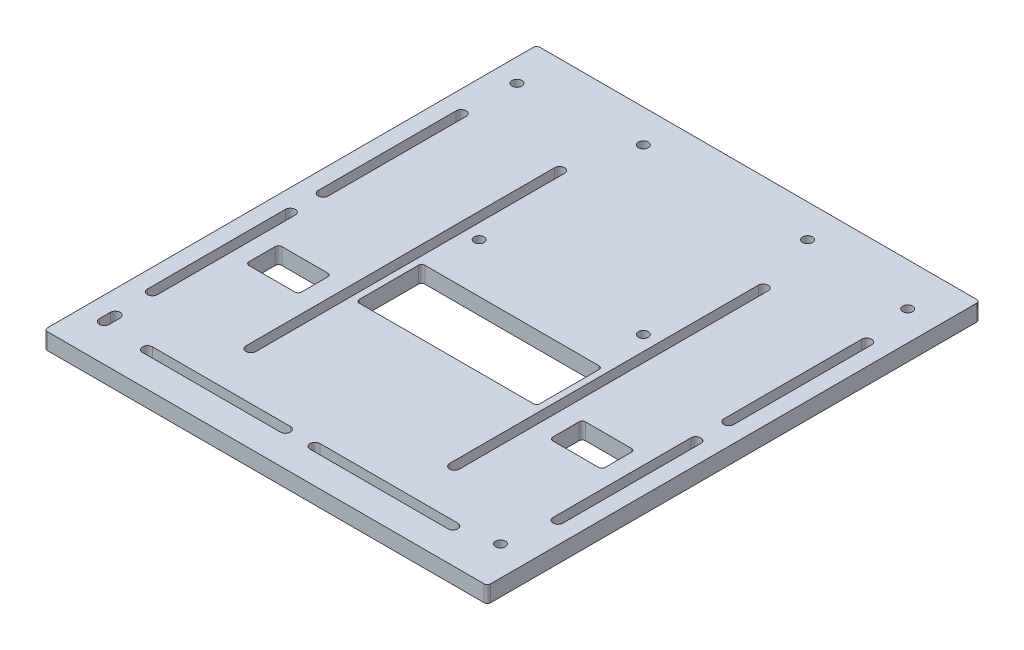
from build123d import *

# Parameters (mm, degrees)
BOSS_EXTRUDE1_DEPTH = 5
CUT_EXTRUDE1_DEPTH  = 5
CUT_EXTRUDE2_DEPTH  = 5
SKETCH7_R           = 1.5
CUT_EXTRUDE3_DEPTH  = 5
CUT_EXTRUDE4_DEPTH  = 5
SKETCH10_R          = 1.5
CUT_EXTRUDE5_DEPTH  = 5
CUT_EXTRUDE6_DEPTH  = 5
CUT_EXTRUDE7_DEPTH  = 5


with BuildPart() as part:
    # Sketch1 → Boss-Extrude1 (new body)
    with BuildSketch(Plane(origin=(0, 0, 0), x_dir=(1, 0, 0), z_dir=(0, 1, 0))):
        with BuildLine():
            Line((-4.859778007, 4.413916891), (128.140221993, 4.413916891))
            ThreePointArc((128.140221993, 4.413916891), (128.847328775, 4.121023672), (129.140221993, 3.413916891))
            Line((129.140221993, 3.413916891), (129.140221993, -144.586083109))
            ThreePointArc((129.140221993, -144.586083109), (128.847328775, -145.29318989), (128.140221993, -145.586083109))
            Line((128.140221993, -145.586083109), (-4.859778007, -145.586083109))
            ThreePointArc((-4.859778007, -145.586083109), (-5.566884788, -145.29318989), (-5.859778007, -144.586083109))
            Line((-5.859778007, -144.586083109), (-5.859778007, 3.413916891))
            ThreePointArc((-5.859778007, 3.413916891), (-5.566884788, 4.121023672), (-4.859778007, 4.413916891))
        make_face()
    extrude(amount=BOSS_EXTRUDE1_DEPTH)

    # Sketch3 → Cut-Extrude1 (cut)
    with BuildSketch(Plane(origin=(75.20450804, 5, 34.196611672), x_dir=(1, 0, 0), z_dir=(0, 1, 0))):
        with BuildLine():
            Line((45.935713953, -83.389471436), (45.935713953, -41.389471436))
            ThreePointArc((45.935713953, -41.389471436), (47.435713953, -39.889471436), (48.935713953, -41.389471436))
            Line((48.935713953, -41.389471436), (48.935713953, -83.389471436))
            ThreePointArc((48.935713953, -83.389471436), (47.435713953, -84.889471436), (45.935713953, -83.389471436))
        make_face()
        with BuildLine():
            Line((45.935713953, -31.389471436), (45.935713953, 10.610528564))
            ThreePointArc((45.935713953, 10.610528564), (47.435713953, 12.110528564), (48.935713953, 10.610528564))
            Line((48.935713953, 10.610528564), (48.935713953, -31.389471436))
            ThreePointArc((48.935713953, -31.389471436), (47.435713953, -32.889471436), (45.935713953, -31.389471436))
        make_face()
        with BuildLine():
            Line((-73.064286047, -84.889471436), (-73.064286047, -42.889471436))
            ThreePointArc((-73.064286047, -42.889471436), (-74.564286047, -41.389471436), (-76.064286047, -42.889471436))
            Line((-76.064286047, -42.889471436), (-76.064286047, -84.889471436))
            ThreePointArc((-76.064286047, -84.889471436), (-74.564286047, -86.389471436), (-73.064286047, -84.889471436))
        make_face()
        with BuildLine():
            Line((-73.064286047, -32.889471436), (-73.064286047, 9.110528564))
            ThreePointArc((-73.064286047, 9.110528564), (-74.564286047, 10.610528564), (-76.064286047, 9.110528564))
            Line((-76.064286047, 9.110528564), (-76.064286047, -32.889471436))
            ThreePointArc((-76.064286047, -32.889471436), (-74.564286047, -34.389471436), (-73.064286047, -32.889471436))
        make_face()
    extrude(amount=-CUT_EXTRUDE1_DEPTH, mode=Mode.SUBTRACT)

    # Sketch5 → Cut-Extrude2 (cut)
    with BuildSketch(Plane(origin=(75.20450804, 5, 34.196611672), x_dir=(1, 0, 0), z_dir=(0, 1, 0))):
        with BuildLine():
            Line((-60.064286047, -99.389471436), (-18.064286047, -99.389471436))
            ThreePointArc((-18.064286047, -99.389471436), (-16.564286047, -100.889471436), (-18.064286047, -102.389471436))
            Line((-18.064286047, -102.389471436), (-60.064286047, -102.389471436))
            ThreePointArc((-60.064286047, -102.389471436), (-61.564286047, -100.889471436), (-60.064286047, -99.389471436))
        make_face()
        with BuildLine():
            Line((-9.064286047, -99.389471436), (32.935713953, -99.389471436))
            ThreePointArc((32.935713953, -99.389471436), (34.435713953, -100.889471436), (32.935713953, -102.389471436))
            Line((32.935713953, -102.389471436), (-9.064286047, -102.389471436))
            ThreePointArc((-9.064286047, -102.389471436), (-10.564286047, -100.889471436), (-9.064286047, -99.389471436))
        make_face()
    extrude(amount=-CUT_EXTRUDE2_DEPTH, mode=Mode.SUBTRACT)

    # Sketch7 → Cut-Extrude3 (cut)
    with BuildSketch(Plane(origin=(75.20450804, 5, 34.196611672), x_dir=(1, 0, 0), z_dir=(0, 1, 0))):
        with Locations(Location((44.935713953, -98.389471436, 0), (0, 0, 270))):
            Circle(SKETCH7_R)
        with Locations(Location((44.935713953, 25.610528564, 0), (0, 0, 90))):
            Circle(SKETCH7_R)
        with Locations(Location((-74.064286047, 25.610528564, 0), (0, 0, 270))):
            Circle(SKETCH7_R)
        with BuildLine():
            Line((-72.564286047, -96.712473991), (-72.564286047, -100.066468882))
            ThreePointArc((-72.564286047, -100.066468882), (-74.064286047, -101.566468882), (-75.564286047, -100.066468882))
            Line((-75.564286047, -100.066468882), (-75.564286047, -96.712473991))
            ThreePointArc((-75.564286047, -96.712473991), (-74.064286047, -95.212473991), (-72.564286047, -96.712473991))
        make_face()
    extrude(amount=-CUT_EXTRUDE3_DEPTH, mode=Mode.SUBTRACT)

    # Sketch9 → Cut-Extrude4 (cut)
    with BuildSketch(Plane(origin=(75.20450804, 5, 34.196611672), x_dir=(1, 0, 0), z_dir=(0, 1, 0))):
        with BuildLine():
            Line((-40.064286047, -36.389471436), (12.935713953, -36.389471436))
            ThreePointArc((12.935713953, -36.389471436), (13.642820734, -36.682364655), (13.935713953, -37.389471436))
            Line((13.935713953, -37.389471436), (13.935713953, -55.389471436))
            ThreePointArc((13.935713953, -55.389471436), (13.642820734, -56.096578218), (12.935713953, -56.389471436))
            Line((12.935713953, -56.389471436), (-40.064286047, -56.389471436))
            ThreePointArc((-40.064286047, -56.389471436), (-40.771392828, -56.096578218), (-41.064286047, -55.389471436))
            Line((-41.064286047, -55.389471436), (-41.064286047, -37.389471436))
            ThreePointArc((-41.064286047, -37.389471436), (-40.771392828, -36.682364655), (-40.064286047, -36.389471436))
        make_face()
    extrude(amount=-CUT_EXTRUDE4_DEPTH, mode=Mode.SUBTRACT)

    # Sketch10 → Cut-Extrude5 (cut)
    with BuildSketch(Plane(origin=(0, 5, 0), x_dir=(1, 0, 0), z_dir=(0, 1, 0))):
        with Locations(Location((36.640221993, -5.586083109, 0), (0, 0, 270))):
            Circle(SKETCH10_R)
        with Locations(Location((86.640221993, -5.586083109, 0), (0, 0, 270))):
            Circle(SKETCH10_R)
        with Locations(Location((86.640221993, -55.586083109, 0), (0, 0, 270))):
            Circle(SKETCH10_R)
        with Locations(Location((36.640221993, -55.586083109, 0), (0, 0, 270))):
            Circle(SKETCH10_R)
    extrude(amount=-CUT_EXTRUDE5_DEPTH, mode=Mode.SUBTRACT)

    # Sketch11 → Cut-Extrude6 (cut)
    with BuildSketch(Plane(origin=(0, 5, 0), x_dir=(1, 0, 0), z_dir=(0, 1, 0))):
        with BuildLine():
            Line((32.140221993, -25.086083109), (32.140221993, -119.086083109))
            ThreePointArc((32.140221993, -119.086083109), (30.640221993, -120.586083109), (29.140221993, -119.086083109))
            Line((29.140221993, -119.086083109), (29.140221993, -25.086083109))
            ThreePointArc((29.140221993, -25.086083109), (30.640221993, -23.586083109), (32.140221993, -25.086083109))
        make_face()
        with BuildLine():
            Line((91.140221993, -25.086083109), (91.140221993, -119.086083109))
            ThreePointArc((91.140221993, -119.086083109), (92.640221993, -120.586083109), (94.140221993, -119.086083109))
            Line((94.140221993, -119.086083109), (94.140221993, -25.086083109))
            ThreePointArc((94.140221993, -25.086083109), (92.640221993, -23.586083109), (91.140221993, -25.086083109))
        make_face()
    extrude(amount=-CUT_EXTRUDE6_DEPTH, mode=Mode.SUBTRACT)

    # Sketch12 → Cut-Extrude7 (cut)
    with BuildSketch(Plane(origin=(0, 5, 0), x_dir=(1, 0, 0), z_dir=(0, 1, 0))):
        with BuildLine():
            Line((22.394580423, -97.440920872), (8.394580423, -97.440920872))
            ThreePointArc((8.394580423, -97.440920872), (7.687473642, -97.148027653), (7.394580423, -96.440920872))
            Line((7.394580423, -96.440920872), (7.394580423, -88.440920872))
            ThreePointArc((7.394580423, -88.440920872), (7.687473642, -87.733814091), (8.394580423, -87.440920872))
            Line((8.394580423, -87.440920872), (22.394580423, -87.440920872))
            ThreePointArc((22.394580423, -87.440920872), (23.101687204, -87.733814091), (23.394580423, -88.440920872))
            Line((23.394580423, -88.440920872), (23.394580423, -96.440920872))
            ThreePointArc((23.394580423, -96.440920872), (23.101687204, -97.148027653), (22.394580423, -97.440920872))
        make_face()
        with BuildLine():
            Line((100.885863564, -87.440920872), (114.885863564, -87.440920872))
            ThreePointArc((114.885863564, -87.440920872), (115.592970345, -87.733814091), (115.885863564, -88.440920872))
            Line((115.885863564, -88.440920872), (115.885863564, -96.440920872))
            ThreePointArc((115.885863564, -96.440920872), (115.592970345, -97.148027653), (114.885863564, -97.440920872))
            Line((114.885863564, -97.440920872), (100.885863564, -97.440920872))
            ThreePointArc((100.885863564, -97.440920872), (100.178756783, -97.148027653), (99.885863564, -96.440920872))
            Line((99.885863564, -96.440920872), (99.885863564, -88.440920872))
            ThreePointArc((99.885863564, -88.440920872), (100.178756783, -87.733814091), (100.885863564, -87.440920872))
        make_face()
    extrude(amount=-CUT_EXTRUDE7_DEPTH, mode=Mode.SUBTRACT)


solid = part.part
